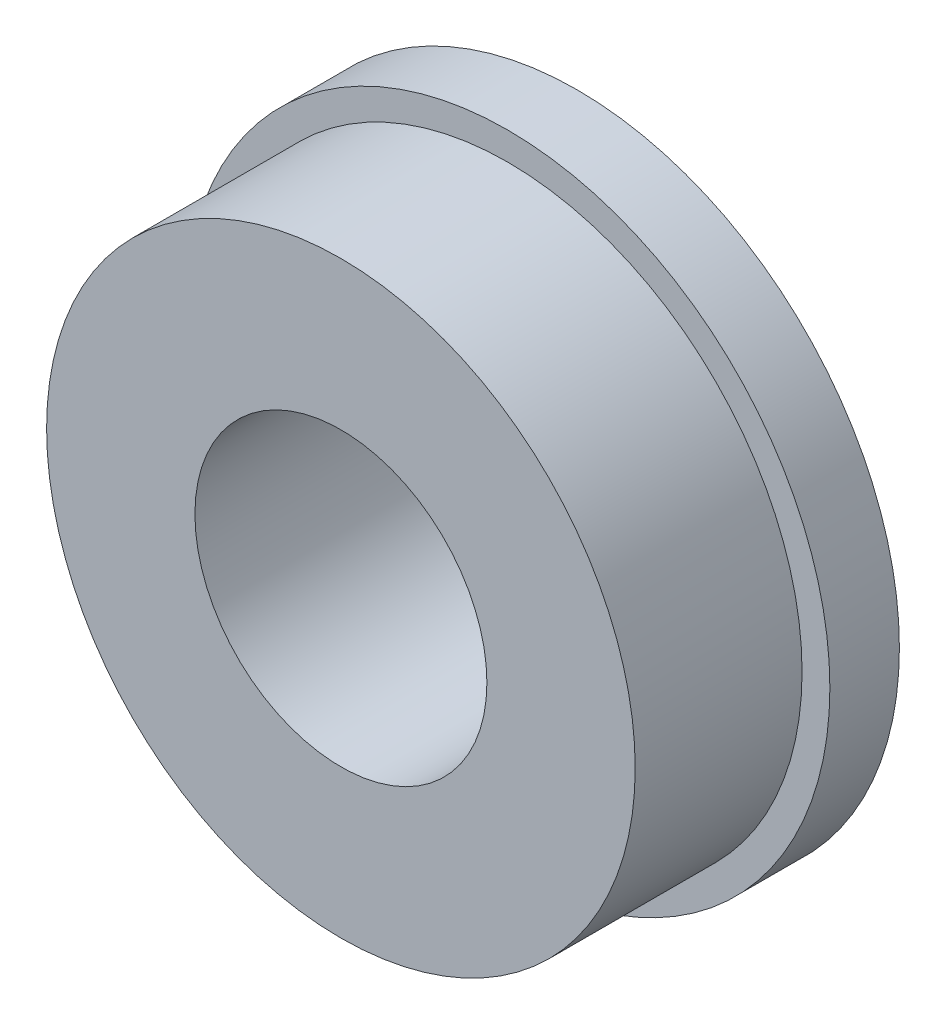
from build123d import *

# Parameters (mm, degrees)
CROQUIS1_R              = 6.95
SALIENTE_EXTRUIR1_DEPTH = 1.5
CROQUIS2_R              = 6.35
SALIENTE_EXTRUIR2_DEPTH = 3.6
CROQUIS3_R              = 3.15
CORTAR_EXTRUIR1_DEPTH   = 12.073165762


with BuildPart() as part:
    # Croquis1 → Saliente-Extruir1 (new body)
    with BuildSketch(Plane.XY):
        Circle(CROQUIS1_R)
    extrude(amount=SALIENTE_EXTRUIR1_DEPTH)

    # Croquis2 → Saliente-Extruir2 (add)
    with BuildSketch(Plane.XY.offset(1.5)):
        Circle(CROQUIS2_R)
    extrude(amount=SALIENTE_EXTRUIR2_DEPTH)

    # Croquis3 → Cortar-Extruir1 (cut, through all)
    with BuildSketch(Plane.XY.offset(5.1)):
        Circle(CROQUIS3_R)
    extrude(amount=-CORTAR_EXTRUIR1_DEPTH, mode=Mode.SUBTRACT)


solid = part.part
